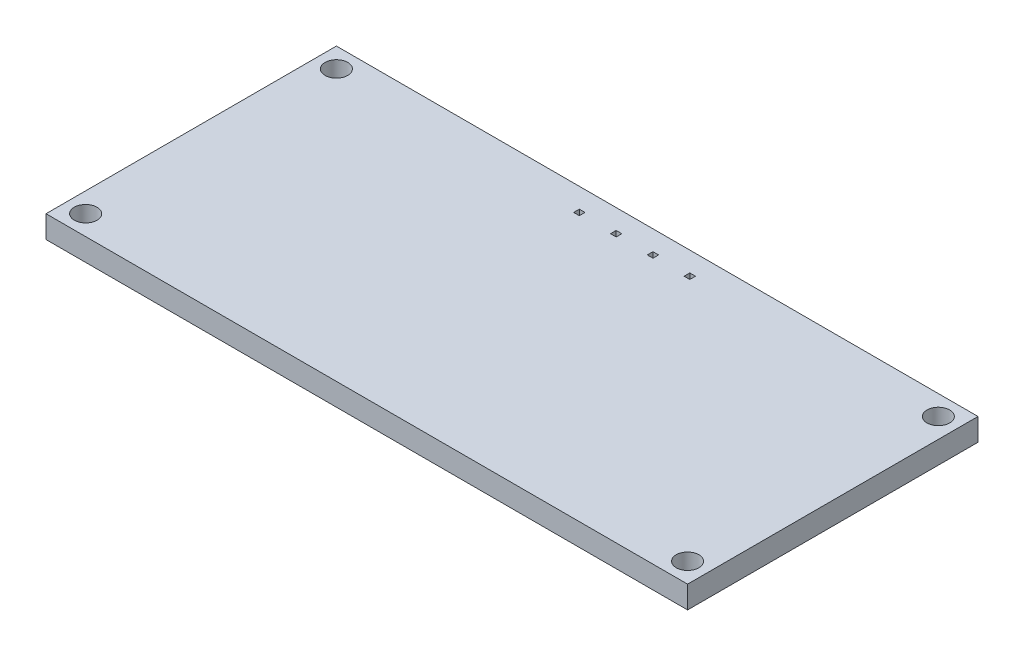
from build123d import *

# Parameters (mm, degrees)
CROQUIS1_W              = 45.31
CROQUIS1_H              = 20.51
CROQUIS1_R              = 0.8
SALIENTE_EXTRUIR1_DEPTH = 1.58
CROQUIS2_W              = 0.4
CROQUIS2_H              = 0.4
CORTAR_EXTRUIR1_DEPTH   = 50.760954573


with BuildPart() as part:
    # Croquis1 → Saliente-Extruir1 (new body)
    with BuildSketch(Plane(origin=(0, 0, 0), x_dir=(1, 0, 0), z_dir=(0, 1, 0))):
        with Locations((22.655, 10.255)):
            Rectangle(CROQUIS1_W, CROQUIS1_H)
        with Locations(Location((1.4, 19.11, 0), (0, 0, 90))):
            Circle(CROQUIS1_R, mode=Mode.SUBTRACT)
        with Locations(Location((43.91, 19.11, 0), (0, 0, 90))):
            Circle(CROQUIS1_R, mode=Mode.SUBTRACT)
        with Locations(Location((1.4, 1.4, 0), (0, 0, 90))):
            Circle(CROQUIS1_R, mode=Mode.SUBTRACT)
        with Locations(Location((43.91, 1.4, 0), (0, 0, 90))):
            Circle(CROQUIS1_R, mode=Mode.SUBTRACT)
    extrude(amount=SALIENTE_EXTRUIR1_DEPTH)

    # Croquis2 → Cortar-Extruir1 (cut, through all)
    with BuildSketch(Plane.XZ):
        with Locations((21.355, -18.91)):
            Rectangle(CROQUIS2_W, CROQUIS2_H)
        with Locations((18.755, -18.91)):
            Rectangle(CROQUIS2_W, CROQUIS2_H)
        with Locations((23.955, -18.91)):
            Rectangle(CROQUIS2_W, CROQUIS2_H)
        with Locations((26.555, -18.91)):
            Rectangle(CROQUIS2_W, CROQUIS2_H)
    extrude(amount=-CORTAR_EXTRUIR1_DEPTH, mode=Mode.SUBTRACT)


solid = part.part
